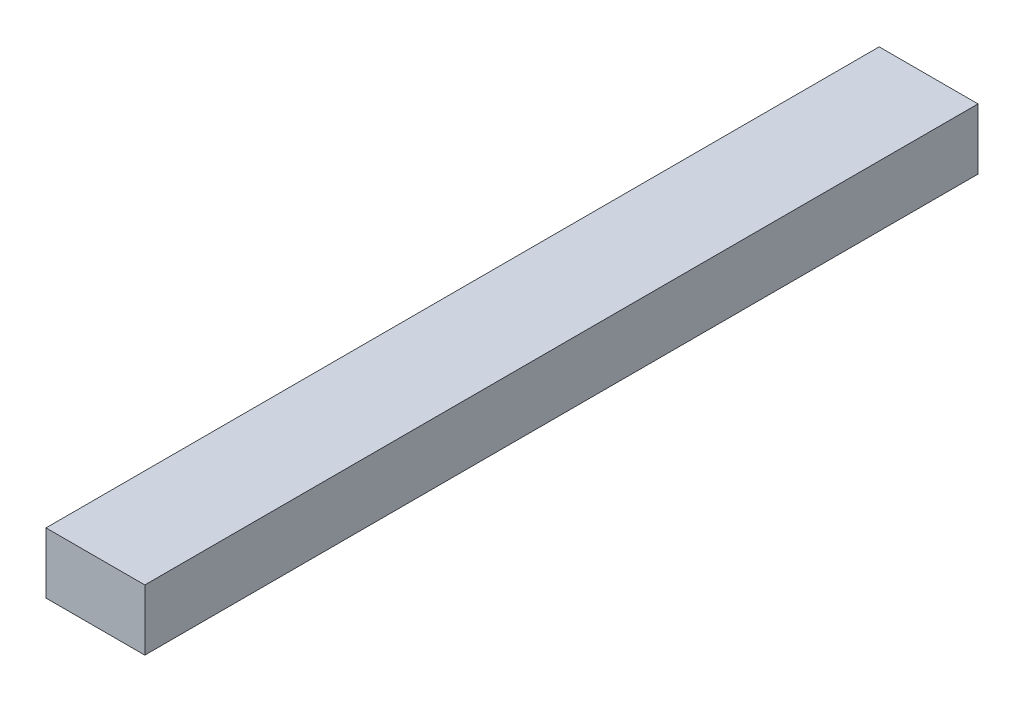
from build123d import *

# Parameters (mm, degrees)
SKETCH1_W           = 30.1244
SKETCH1_H           = 18.542
BOSS_EXTRUDE1_DEPTH = 254


with BuildPart() as part:
    # Sketch1 → Boss-Extrude1 (new body)
    with BuildSketch(Plane.XY):
        with Locations((1.469482927, -1.933807317)):
            Rectangle(SKETCH1_W, SKETCH1_H)
    extrude(amount=BOSS_EXTRUDE1_DEPTH)


solid = part.part
